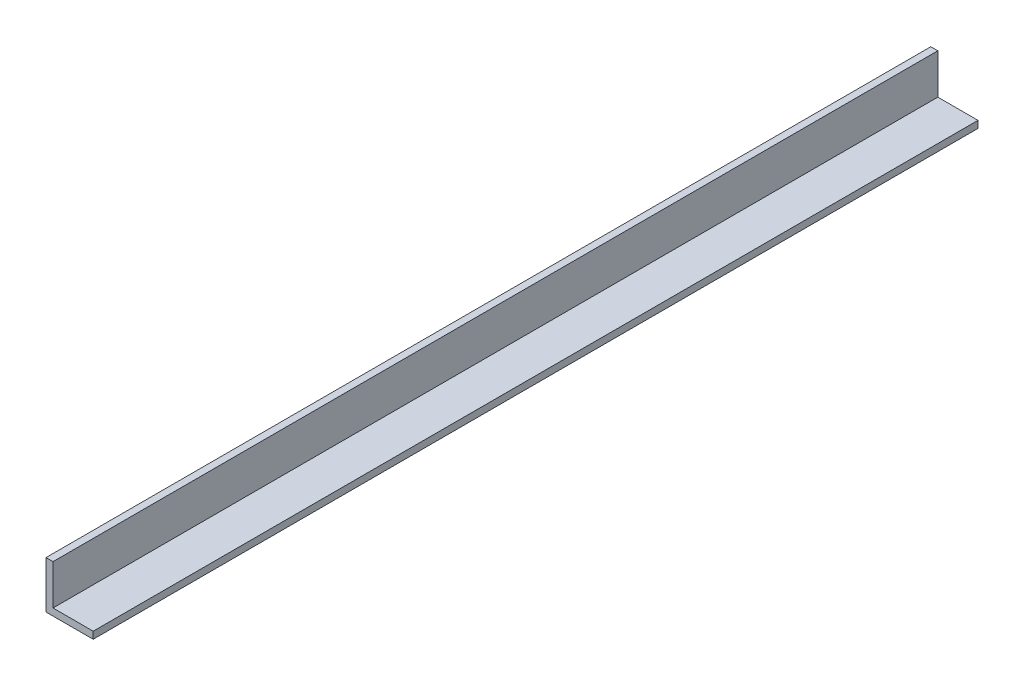
from build123d import *

# Parameters (mm, degrees)
SALIENTE_EXTRUIR1_DEPTH = 300


with BuildPart() as part:
    # Croquis1 → Saliente-Extruir1 (new, symmetric)
    with BuildSketch(Plane.XY):
        Polygon((0, 0), (0, 27.24), (-4.7625, 27.24), (-4.7625, -4.76), (27.2375, -4.76), (27.2375, 0), align=None)
    extrude(amount=SALIENTE_EXTRUIR1_DEPTH, both=True)


solid = part.part
